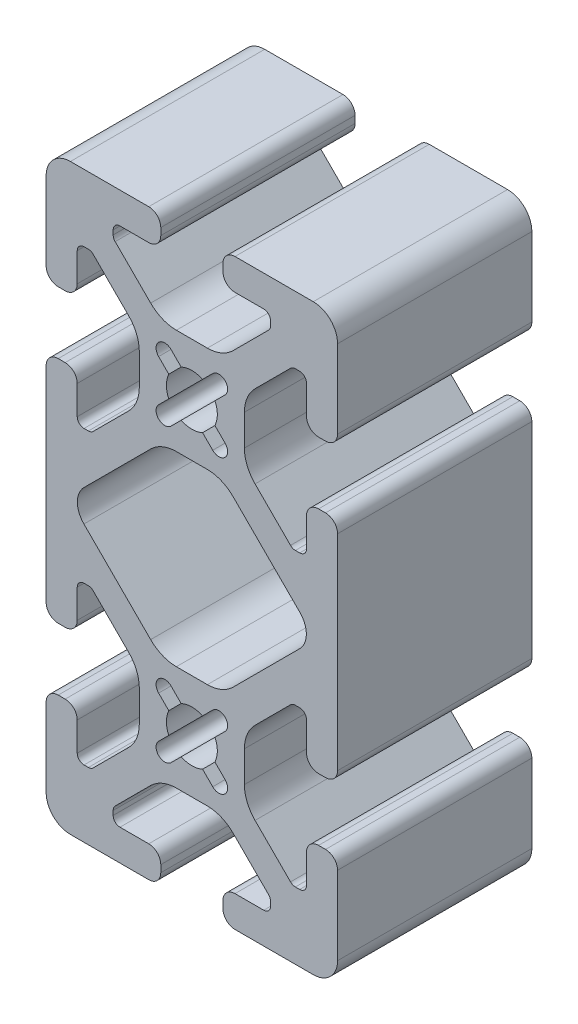
from build123d import *

# Parameters (mm, degrees)
BOSS_EXTRUDE1_DEPTH = 25.4


with BuildPart() as part:
    # Sketch1 → Boss-Extrude1 (new body)
    with BuildSketch(Plane(origin=(0, 0, -25.4), x_dir=(-1, 0, 0), z_dir=(0, 0, -1))):
        with BuildLine():
            Line((17.4752, 34.036), (16.5608, 34.036))
            ThreePointArc((16.5608, 34.036), (15.447248241, 33.574751759), (14.986, 32.4612))
            Line((14.986, 32.4612), (14.986, 28.702))
            ThreePointArc((14.986, 28.702), (14.725617928, 28.073382072), (14.097, 27.813))
            Line((14.097, 27.813), (13.528917816, 27.813))
            ThreePointArc((13.528917816, 27.813), (13.188712244, 27.880671096), (12.900299887, 28.073382072))
            Line((12.900299887, 28.073382072), (8.260840398, 32.712841561))
            ThreePointArc((8.260840398, 32.712841561), (7.231213183, 34.253787583), (6.869656187, 36.07145735))
            Line((6.869656187, 36.07145735), (6.869656187, 40.12854265))
            ThreePointArc((6.869656187, 40.12854265), (7.231213183, 41.946212417), (8.260840398, 43.487158439))
            Line((8.260840398, 43.487158439), (12.900299887, 48.126617928))
            ThreePointArc((12.900299887, 48.126617928), (13.188712244, 48.319328904), (13.528917816, 48.387))
            Line((13.528917816, 48.387), (14.097, 48.387))
            ThreePointArc((14.097, 48.387), (14.725617928, 48.126617928), (14.986, 47.498))
            Line((14.986, 47.498), (14.986, 43.7388))
            ThreePointArc((14.986, 43.7388), (15.447248241, 42.625248241), (16.5608, 42.164))
            Line((16.5608, 42.164), (17.4752, 42.164))
            ThreePointArc((17.4752, 42.164), (18.588751759, 42.625248241), (19.05, 43.7388))
            Line((19.05, 43.7388), (19.05, 53.975))
            ThreePointArc((19.05, 53.975), (18.12006403, 56.22006403), (15.875, 57.15))
            Line((15.875, 57.15), (5.6388, 57.15))
            ThreePointArc((5.6388, 57.15), (4.525248241, 56.688751759), (4.064, 55.5752))
            Line((4.064, 55.5752), (4.064, 54.6608))
            ThreePointArc((4.064, 54.6608), (4.525248241, 53.547248241), (5.6388, 53.086))
            Line((5.6388, 53.086), (9.398, 53.086))
            ThreePointArc((9.398, 53.086), (10.026617928, 52.825617928), (10.287, 52.197))
            Line((10.287, 52.197), (10.287, 51.628917816))
            ThreePointArc((10.287, 51.628917816), (10.219328904, 51.288712244), (10.026617928, 51.000299887))
            Line((10.026617928, 51.000299887), (5.387158439, 46.360840398))
            ThreePointArc((5.387158439, 46.360840398), (3.846212417, 45.331213183), (2.02854265, 44.969656187))
            Line((2.02854265, 44.969656187), (-2.02854265, 44.969656187))
            ThreePointArc((-2.02854265, 44.969656187), (-3.846212417, 45.331213183), (-5.387158439, 46.360840398))
            Line((-5.387158439, 46.360840398), (-10.026617928, 51.000299887))
            ThreePointArc((-10.026617928, 51.000299887), (-10.219328904, 51.288712244), (-10.287, 51.628917816))
            Line((-10.287, 51.628917816), (-10.287, 52.197))
            ThreePointArc((-10.287, 52.197), (-10.026617928, 52.825617928), (-9.398, 53.086))
            Line((-9.398, 53.086), (-5.6388, 53.086))
            ThreePointArc((-5.6388, 53.086), (-4.525248241, 53.547248241), (-4.064, 54.6608))
            Line((-4.064, 54.6608), (-4.064, 55.5752))
            ThreePointArc((-4.064, 55.5752), (-4.525248241, 56.688751759), (-5.6388, 57.15))
            Line((-5.6388, 57.15), (-15.875, 57.15))
            ThreePointArc((-15.875, 57.15), (-18.12006403, 56.22006403), (-19.05, 53.975))
            Line((-19.05, 53.975), (-19.05, 43.7388))
            ThreePointArc((-19.05, 43.7388), (-18.588751759, 42.625248241), (-17.4752, 42.164))
            Line((-17.4752, 42.164), (-16.5608, 42.164))
            ThreePointArc((-16.5608, 42.164), (-15.447248241, 42.625248241), (-14.986, 43.7388))
            Line((-14.986, 43.7388), (-14.986, 47.498))
            ThreePointArc((-14.986, 47.498), (-14.725617928, 48.126617928), (-14.097, 48.387))
            Line((-14.097, 48.387), (-13.528917816, 48.387))
            ThreePointArc((-13.528917816, 48.387), (-13.188712244, 48.319328904), (-12.900299887, 48.126617928))
            Line((-12.900299887, 48.126617928), (-8.260840398, 43.487158439))
            ThreePointArc((-8.260840398, 43.487158439), (-7.231213183, 41.946212417), (-6.869656187, 40.12854265))
            Line((-6.869656187, 40.12854265), (-6.869656187, 36.07145735))
            ThreePointArc((-6.869656187, 36.07145735), (-7.231213183, 34.253787583), (-8.260840398, 32.712841561))
            Line((-8.260840398, 32.712841561), (-12.900299887, 28.073382072))
            ThreePointArc((-12.900299887, 28.073382072), (-13.188712244, 27.880671096), (-13.528917816, 27.813))
            Line((-13.528917816, 27.813), (-14.097, 27.813))
            ThreePointArc((-14.097, 27.813), (-14.725617928, 28.073382072), (-14.986, 28.702))
            Line((-14.986, 28.702), (-14.986, 32.4612))
            ThreePointArc((-14.986, 32.4612), (-15.447248241, 33.574751759), (-16.5608, 34.036))
            Line((-16.5608, 34.036), (-17.4752, 34.036))
            ThreePointArc((-17.4752, 34.036), (-18.588751759, 33.574751759), (-19.05, 32.4612))
            Line((-19.05, 32.4612), (-19.05, 5.6388))
            ThreePointArc((-19.05, 5.6388), (-18.588751759, 4.525248241), (-17.4752, 4.064))
            Line((-17.4752, 4.064), (-16.5608, 4.064))
            ThreePointArc((-16.5608, 4.064), (-15.447248241, 4.525248241), (-14.986, 5.6388))
            Line((-14.986, 5.6388), (-14.986, 9.398))
            ThreePointArc((-14.986, 9.398), (-14.725617928, 10.026617928), (-14.097, 10.287))
            Line((-14.097, 10.287), (-13.528917816, 10.287))
            ThreePointArc((-13.528917816, 10.287), (-13.188712244, 10.219328904), (-12.900299887, 10.026617928))
            Line((-12.900299887, 10.026617928), (-8.260840398, 5.387158439))
            ThreePointArc((-8.260840398, 5.387158439), (-7.231213183, 3.846212417), (-6.869656187, 2.02854265))
            Line((-6.869656187, 2.02854265), (-6.869656187, -2.02854265))
            ThreePointArc((-6.869656187, -2.02854265), (-7.231213183, -3.846212417), (-8.260840398, -5.387158439))
            Line((-8.260840398, -5.387158439), (-12.900299887, -10.026617928))
            ThreePointArc((-12.900299887, -10.026617928), (-13.188712244, -10.219328904), (-13.528917816, -10.287))
            Line((-13.528917816, -10.287), (-14.097, -10.287))
            ThreePointArc((-14.097, -10.287), (-14.725617928, -10.026617928), (-14.986, -9.398))
            Line((-14.986, -9.398), (-14.986, -5.6388))
            ThreePointArc((-14.986, -5.6388), (-15.447248241, -4.525248241), (-16.5608, -4.064))
            Line((-16.5608, -4.064), (-17.4752, -4.064))
            ThreePointArc((-17.4752, -4.064), (-18.588751759, -4.525248241), (-19.05, -5.6388))
            Line((-19.05, -5.6388), (-19.05, -15.875))
            ThreePointArc((-19.05, -15.875), (-18.12006403, -18.12006403), (-15.875, -19.05))
            Line((-15.875, -19.05), (-5.6388, -19.05))
            ThreePointArc((-5.6388, -19.05), (-4.525248241, -18.588751759), (-4.064, -17.4752))
            Line((-4.064, -17.4752), (-4.064, -16.5608))
            ThreePointArc((-4.064, -16.5608), (-4.525248241, -15.447248241), (-5.6388, -14.986))
            Line((-5.6388, -14.986), (-9.398, -14.986))
            ThreePointArc((-9.398, -14.986), (-10.026617928, -14.725617928), (-10.287, -14.097))
            Line((-10.287, -14.097), (-10.287, -13.528917816))
            ThreePointArc((-10.287, -13.528917816), (-10.219328904, -13.188712244), (-10.026617928, -12.900299887))
            Line((-10.026617928, -12.900299887), (-5.387158439, -8.260840398))
            ThreePointArc((-5.387158439, -8.260840398), (-3.846212417, -7.231213183), (-2.02854265, -6.869656187))
            Line((-2.02854265, -6.869656187), (2.02854265, -6.869656187))
            ThreePointArc((2.02854265, -6.869656187), (3.846212417, -7.231213183), (5.387158439, -8.260840398))
            Line((5.387158439, -8.260840398), (10.026617928, -12.900299887))
            ThreePointArc((10.026617928, -12.900299887), (10.219328904, -13.188712244), (10.287, -13.528917816))
            Line((10.287, -13.528917816), (10.287, -14.097))
            ThreePointArc((10.287, -14.097), (10.026617928, -14.725617928), (9.398, -14.986))
            Line((9.398, -14.986), (5.6388, -14.986))
            ThreePointArc((5.6388, -14.986), (4.525248241, -15.447248241), (4.064, -16.5608))
            Line((4.064, -16.5608), (4.064, -17.4752))
            ThreePointArc((4.064, -17.4752), (4.525248241, -18.588751759), (5.6388, -19.05))
            Line((5.6388, -19.05), (15.875, -19.05))
            ThreePointArc((15.875, -19.05), (18.12006403, -18.12006403), (19.05, -15.875))
            Line((19.05, -15.875), (19.05, -5.6388))
            ThreePointArc((19.05, -5.6388), (18.588751759, -4.525248241), (17.4752, -4.064))
            Line((17.4752, -4.064), (16.5608, -4.064))
            ThreePointArc((16.5608, -4.064), (15.447248241, -4.525248241), (14.986, -5.6388))
            Line((14.986, -5.6388), (14.986, -9.398))
            ThreePointArc((14.986, -9.398), (14.725617928, -10.026617928), (14.097, -10.287))
            Line((14.097, -10.287), (13.528917816, -10.287))
            ThreePointArc((13.528917816, -10.287), (13.188712244, -10.219328904), (12.900299887, -10.026617928))
            Line((12.900299887, -10.026617928), (8.260840398, -5.387158439))
            ThreePointArc((8.260840398, -5.387158439), (7.231213183, -3.846212417), (6.869656187, -2.02854265))
            Line((6.869656187, -2.02854265), (6.869656187, 2.02854265))
            ThreePointArc((6.869656187, 2.02854265), (7.231213183, 3.846212417), (8.260840398, 5.387158439))
            Line((8.260840398, 5.387158439), (12.900299887, 10.026617928))
            ThreePointArc((12.900299887, 10.026617928), (13.188712244, 10.219328904), (13.528917816, 10.287))
            Line((13.528917816, 10.287), (14.097, 10.287))
            ThreePointArc((14.097, 10.287), (14.725617928, 10.026617928), (14.986, 9.398))
            Line((14.986, 9.398), (14.986, 5.6388))
            ThreePointArc((14.986, 5.6388), (15.447248241, 4.525248241), (16.5608, 4.064))
            Line((16.5608, 4.064), (17.4752, 4.064))
            ThreePointArc((17.4752, 4.064), (18.588751759, 4.525248241), (19.05, 5.6388))
            Line((19.05, 5.6388), (19.05, 32.4612))
            ThreePointArc((19.05, 32.4612), (18.588751759, 33.574751759), (17.4752, 34.036))
        make_face()
        with BuildLine():
            Line((5.387158439, 29.839159602), (14.110859133, 21.115458908))
            ThreePointArc((14.110859133, 21.115458908), (14.966400226, 19.05), (14.110859133, 16.984541092))
            Line((14.110859133, 16.984541092), (5.387158439, 8.260840398))
            ThreePointArc((5.387158439, 8.260840398), (3.846212417, 7.231213183), (2.02854265, 6.869656187))
            Line((2.02854265, 6.869656187), (-2.02854265, 6.869656187))
            ThreePointArc((-2.02854265, 6.869656187), (-3.846212417, 7.231213183), (-5.387158439, 8.260840398))
            Line((-5.387158439, 8.260840398), (-14.110859133, 16.984541092))
            ThreePointArc((-14.110859133, 16.984541092), (-14.966400226, 19.05), (-14.110859133, 21.115458908))
            Line((-14.110859133, 21.115458908), (-5.387158439, 29.839159602))
            ThreePointArc((-5.387158439, 29.839159602), (-3.846212417, 30.868786817), (-2.02854265, 31.230343813))
            Line((-2.02854265, 31.230343813), (2.02854265, 31.230343813))
            ThreePointArc((2.02854265, 31.230343813), (3.846212417, 30.868786817), (5.387158439, 29.839159602))
        make_face(mode=Mode.SUBTRACT)
        with BuildLine():
            Line((1.401430967, 3.017877069), (2.72685484, 4.343300942))
            ThreePointArc((2.72685484, 4.343300942), (4.343300937, 4.343300943), (4.34330094, 2.726854846))
            Line((4.34330094, 2.726854846), (3.017877069, 1.401430967))
            ThreePointArc((3.017877069, 1.401430967), (3.3274, 9e-09), (3.017877077, -1.40143095))
            Line((3.017877077, -1.40143095), (4.343300961, -2.726854828))
            ThreePointArc((4.343300961, -2.726854828), (4.343300966, -4.343300942), (2.726854852, -4.343300946))
            Line((2.726854852, -4.343300946), (1.401430967, -3.017877069))
            ThreePointArc((1.401430967, -3.017877069), (9e-09, -3.3274), (-1.40143095, -3.017877077))
            Line((-1.40143095, -3.017877077), (-2.726854834, -4.343300967))
            ThreePointArc((-2.726854834, -4.343300967), (-4.343300953, -4.343300971), (-4.343300954, -2.726854852))
            Line((-4.343300954, -2.726854852), (-3.017877069, -1.401430967))
            ThreePointArc((-3.017877069, -1.401430967), (-3.3274, -9e-09), (-3.017877077, 1.40143095))
            Line((-3.017877077, 1.40143095), (-4.343300961, 2.726854828))
            ThreePointArc((-4.343300961, 2.726854828), (-4.343300966, 4.343300942), (-2.726854852, 4.343300946))
            Line((-2.726854852, 4.343300946), (-1.401430967, 3.017877069))
            ThreePointArc((-1.401430967, 3.017877069), (0, 3.3274), (1.401430967, 3.017877069))
        make_face(mode=Mode.SUBTRACT)
        with BuildLine():
            Line((3.017877073, 36.698569024), (4.343300948, 35.373145156))
            ThreePointArc((4.343300948, 35.373145156), (4.343300954, 33.756699073), (2.726854871, 33.756699063))
            Line((2.726854871, 33.756699063), (1.401430985, 35.082122929))
            ThreePointArc((1.401430985, 35.082122929), (2.9e-08, 34.772599992), (-1.401430933, 35.082122908))
            Line((-1.401430933, 35.082122908), (-2.726854762, 33.756699066))
            ThreePointArc((-2.726854762, 33.756699066), (-4.343300901, 33.75669906), (-4.343300903, 35.373145199))
            Line((-4.343300903, 35.373145199), (-3.017877069, 36.698569033))
            ThreePointArc((-3.017877069, 36.698569033), (-3.327399996, 38.099999979), (-3.017877079, 39.501430928))
            Line((-3.017877079, 39.501430928), (-4.343300948, 40.826854777))
            ThreePointArc((-4.343300948, 40.826854777), (-4.343300957, 42.443300899), (-2.726854835, 42.443300905))
            Line((-2.726854835, 42.443300905), (-1.401430977, 41.117877054))
            ThreePointArc((-1.401430977, 41.117877054), (-8e-09, 41.427399992), (1.401430963, 41.117877065))
            Line((1.401430963, 41.117877065), (2.726854864, 42.443300966))
            ThreePointArc((2.726854864, 42.443300966), (4.343300963, 42.443300968), (4.343300969, 40.826854869))
            Line((4.343300969, 40.826854869), (3.017877073, 39.501430959))
            ThreePointArc((3.017877073, 39.501430959), (3.327400004, 38.099999992), (3.017877073, 36.698569024))
        make_face(mode=Mode.SUBTRACT)
    extrude(amount=-BOSS_EXTRUDE1_DEPTH)


solid = part.part
